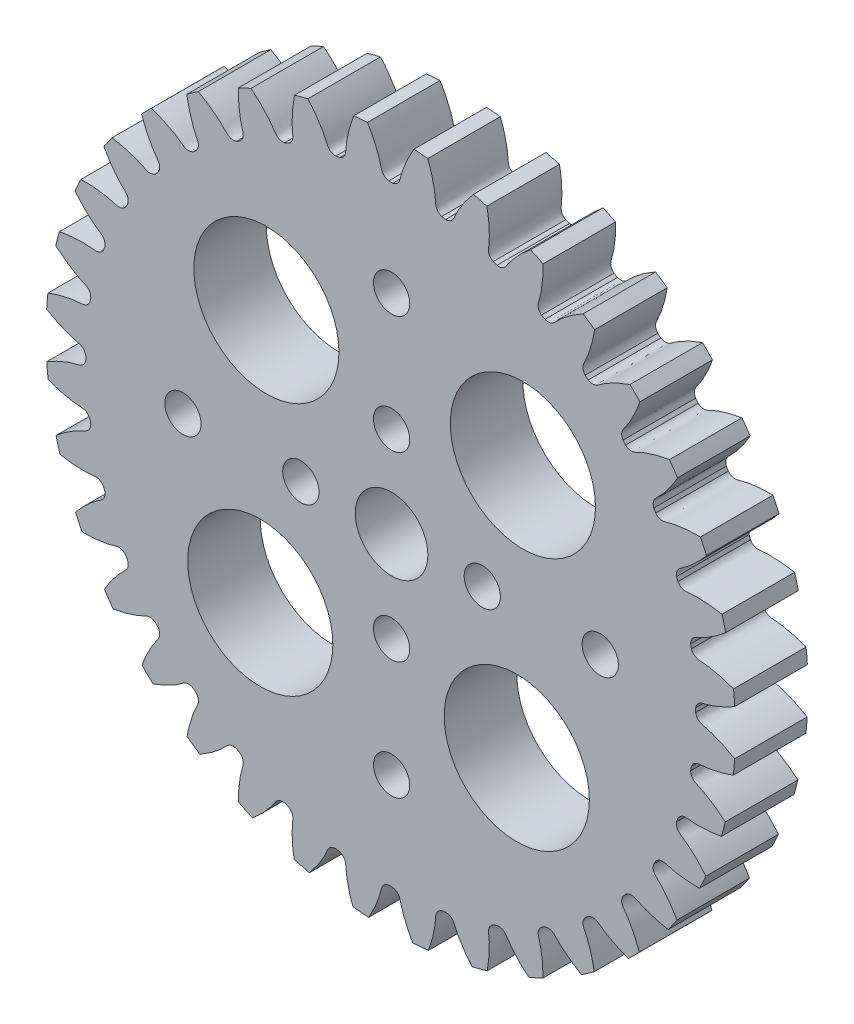
from build123d import *

# Parameters (mm, degrees)
SKETCH_1_R      = 2
SKETCH_1_R_2    = 1
SKETCH_1_R_3    = 4
EXTRUDE_1_DEPTH = 4


with BuildPart() as part:
    # 草图1 → 凸台-拉伸1 (new body)
    with BuildSketch(Plane.XY):
        with BuildLine():
            ThreePointArc((-459.348027108, -100.926579021), (-459.456289472, -100.9453027), (-459.564426692, -100.964736106))
            add(Edge.make_bspline(
                [(-459.564426692, -100.964736106), (-459.933069433, -100.947728892), (-460.010211926, -100.688966681), (-460.133844204, -100.4222656), (-460.170612131, -100.346544695), (-460.227853895, -100.234569806), (-460.311855228, -100.082027758), (-460.430371508, -99.885766039), (-460.571520927, -99.67178836), (-460.736888328, -99.441628893), (-460.914866275, -99.213695983), (-461.040142881, -99.064645204), (-461.099923334, -98.995759227)],
                knots=[0, 0, 0, 0, 0.120371484, 0.133302531, 0.147363917, 0.16255564, 0.196330101, 0.234625915, 0.277443082, 0.324781601, 0.376641473, 0.422355164, 0.422355164, 0.422355164, 0.422355164], degree=3))
            ThreePointArc((-461.099923334, -98.995759227), (-461.469592827, -99.091140869), (-461.83727124, -99.193930832))
            add(Edge.make_bspline(
                [(-462.182439522, -101.666230616), (-461.87168915, -101.467180565), (-461.934262897, -101.204514671), (-461.960544744, -100.911728621), (-461.966563238, -100.827768429), (-461.97297786, -100.702174449), (-461.976501596, -100.528068494), (-461.971994346, -100.298842719), (-461.956744203, -100.042957903), (-461.928611566, -99.760950258), (-461.888474433, -99.47477831), (-461.854552188, -99.283268508), (-461.83727124, -99.193930832)],
                knots=[0, 0, 0, 0, 0.120371484, 0.133302531, 0.147363917, 0.16255564, 0.196330101, 0.234625915, 0.277443082, 0.324781601, 0.376641473, 0.422247529, 0.422247529, 0.422247529, 0.422247529], degree=3))
            ThreePointArc((-462.182439522, -101.666230616), (-462.285805805, -101.703469402), (-462.388925602, -101.741385402))
            add(Edge.make_bspline(
                [(-462.388925602, -101.741385402), (-462.754921104, -101.788650706), (-462.875825215, -101.547215328), (-463.043891397, -101.306034556), (-463.093249534, -101.237848704), (-463.169065903, -101.137514894), (-463.278279715, -101.00187698), (-463.429075957, -100.829177054), (-463.605237833, -100.642960516), (-463.808059704, -100.445013437), (-464.022047788, -100.252229175), (-464.170382718, -100.127913898), (-464.240288777, -100.071161198)],
                knots=[0, 0, 0, 0, 0.120371484, 0.133302531, 0.147363917, 0.16255564, 0.196330101, 0.234625915, 0.277443082, 0.324781601, 0.376641473, 0.421771001, 0.421771001, 0.421771001, 0.421771001], degree=3))
            ThreePointArc((-464.240288777, -100.071161198), (-464.589184221, -100.230109869), (-464.934801412, -100.396066095))
            add(Edge.make_bspline(
                [(-464.845351691, -102.886835791), (-464.573886994, -102.636848522), (-464.681121559, -102.38903893), (-464.75784589, -102.105264753), (-464.778352484, -102.023625206), (-464.80647882, -101.901053168), (-464.840182204, -101.730204164), (-464.875548067, -101.503678168), (-464.90496354, -101.249032658), (-464.926228415, -100.966424161), (-464.936348448, -100.678932408), (-464.9362444, -100.485745285), (-464.934801412, -100.396066095)],
                knots=[0, 0, 0, 0, 0.120371484, 0.133302531, 0.147363917, 0.16255564, 0.196330101, 0.234625915, 0.277443082, 0.324781601, 0.376641473, 0.421594522, 0.421594522, 0.421594522, 0.421594522], degree=3))
            ThreePointArc((-464.845351691, -102.886835791), (-464.94068116, -102.941458203), (-465.035650292, -102.996704739))
            add(Edge.make_bspline(
                [(-465.035650292, -102.996704739), (-465.387877966, -103.106806429), (-465.548870085, -102.890033775), (-465.756263566, -102.681701467), (-465.816712191, -102.623122462), (-465.908799522, -102.537478322), (-466.039907407, -102.422865833), (-466.218401743, -102.278975099), (-466.424223487, -102.126177798), (-466.658337187, -101.966457627), (-466.90107597, -101.814683076), (-467.067205944, -101.718830417), (-467.144358934, -101.675877448)],
                knots=[0, 0, 0, 0, 0.120371484, 0.133302531, 0.147363917, 0.16255564, 0.196330101, 0.234625915, 0.277443082, 0.324781601, 0.376641473, 0.420899304, 0.420899304, 0.420899304, 0.420899304], degree=3))
            ThreePointArc((-467.144358934, -101.675877448), (-467.462218462, -101.894456412), (-467.775574852, -102.11944356))
            add(Edge.make_bspline(
                [(-467.255852377, -104.551307077), (-467.031921672, -104.257978326), (-467.180558787, -104.032554605), (-467.305394372, -103.766414636), (-467.339765983, -103.68957631), (-467.388749427, -103.573750503), (-467.4516084, -103.411349611), (-467.525772802, -103.194406271), (-467.598960117, -102.948737342), (-467.668976381, -102.67411491), (-467.728476154, -102.394575396), (-467.761661729, -102.206157446), (-467.775574852, -102.11944356)],
                knots=[0, 0, 0, 0, 0.120371484, 0.133302531, 0.147363917, 0.16255564, 0.196330101, 0.234625915, 0.277443082, 0.324781601, 0.376641473, 0.420658365, 0.420658365, 0.420658365, 0.420658365], degree=3))
            ThreePointArc((-467.255852377, -104.551307077), (-467.340248495, -104.62165344), (-467.424181371, -104.692551874))
            add(Edge.make_bspline(
                [(-467.424181371, -104.692551874), (-467.751938958, -104.862144565), (-467.948127421, -104.676621163), (-468.188546655, -104.507467391), (-468.258249067, -104.460275127), (-468.363809333, -104.39192291), (-468.512827645, -104.301818288), (-468.713596615, -104.191108794), (-468.942824437, -104.076373397), (-469.20111654, -103.959733153), (-469.464428245, -103.853262543), (-469.642527543, -103.788412462), (-469.723810371, -103.760185061)],
                knots=[0, 0, 0, 0, 0.120371484, 0.133302531, 0.147363917, 0.16255564, 0.196330101, 0.234625915, 0.277443082, 0.324781601, 0.376641473, 0.419767084, 0.419767084, 0.419767084, 0.419767084], degree=3))
            ThreePointArc((-469.723810371, -103.760185061), (-470.000963189, -104.032852292), (-470.27247872, -104.31113348))
            add(Edge.make_bspline(
                [(-469.340699735, -106.609070355), (-469.171107044, -106.281312768), (-469.356630446, -106.085124304), (-469.525784218, -105.844705071), (-469.572976482, -105.775002659), (-469.641328698, -105.669442393), (-469.731433321, -105.520424081), (-469.842142815, -105.319655111), (-469.956878212, -105.090427289), (-470.073518456, -104.832135186), (-470.179765186, -104.569377156), (-470.244430425, -104.391846416), (-470.27247872, -104.31113348)],
                knots=[0, 0, 0, 0, 0.120371484, 0.133302531, 0.147363917, 0.16255564, 0.196330101, 0.234625915, 0.277443082, 0.324781601, 0.376641473, 0.419467813, 0.419467813, 0.419467813, 0.419467813], degree=3))
            ThreePointArc((-469.340699735, -106.609070355), (-469.411598169, -106.693003231), (-469.481944532, -106.777399349))
            add(Edge.make_bspline(
                [(-469.481944532, -106.777399349), (-469.775273283, -107.001330054), (-470.000697004, -106.852692939), (-470.266836973, -106.727857354), (-470.343675299, -106.693485743), (-470.459501106, -106.644502298), (-470.621901998, -106.581643326), (-470.838845338, -106.507478923), (-471.084514267, -106.434291609), (-471.359136699, -106.364275345), (-471.634286203, -106.305709982), (-471.818254999, -106.273150739), (-471.900517359, -106.259819993)],
                knots=[0, 0, 0, 0, 0.120371484, 0.133302531, 0.147363917, 0.16255564, 0.196330101, 0.234625915, 0.277443082, 0.324781601, 0.376641473, 0.418409251, 0.418409251, 0.418409251, 0.418409251], degree=3))
            ThreePointArc((-471.900517359, -106.259819993), (-472.128129052, -106.579462013), (-472.349091098, -106.903736399))
            add(Edge.make_bspline(
                [(-471.036546734, -108.997601529), (-470.926445044, -108.645373855), (-471.143217698, -108.484381736), (-471.351550007, -108.276988255), (-471.410129011, -108.21653963), (-471.495773151, -108.124452299), (-471.61038564, -107.993344413), (-471.754276374, -107.814850078), (-471.907073676, -107.609028334), (-472.066793846, -107.374914634), (-472.215563905, -107.136981049), (-472.308751868, -106.975859374), (-472.349091098, -106.903736399)],
                knots=[0, 0, 0, 0, 0.120371484, 0.133302531, 0.147363917, 0.16255564, 0.196330101, 0.234625915, 0.277443082, 0.324781601, 0.376641473, 0.418059479, 0.418059479, 0.418059479, 0.418059479], degree=3))
            ThreePointArc((-471.036546734, -108.997601529), (-471.09179327, -109.09257066), (-471.146415682, -109.187900129))
            add(Edge.make_bspline(
                [(-471.146415682, -109.187900129), (-471.396402951, -109.459364827), (-471.644212543, -109.352130262), (-471.92798672, -109.27540593), (-472.009626267, -109.254899337), (-472.132198305, -109.226773001), (-472.30304731, -109.193069617), (-472.529573306, -109.157703754), (-472.784218815, -109.128288281), (-473.066827312, -109.107023406), (-473.344891605, -109.09723523), (-473.528641316, -109.097013991), (-473.608894091, -109.098041616)],
                knots=[0, 0, 0, 0, 0.120371484, 0.133302531, 0.147363917, 0.16255564, 0.196330101, 0.234625915, 0.277443082, 0.324781601, 0.376641473, 0.416867492, 0.416867492, 0.416867492, 0.416867492], degree=3))
            ThreePointArc((-473.608894091, -109.098041616), (-473.779236201, -109.456047275), (-473.94207128, -109.817529256))
            add(Edge.make_bspline(
                [(-472.291865921, -111.644326289), (-472.244600617, -111.278330787), (-472.486035995, -111.157426676), (-472.727216768, -110.989360494), (-472.795402619, -110.940002356), (-472.895736429, -110.864185988), (-473.031374343, -110.754972176), (-473.204074269, -110.604175934), (-473.390290807, -110.428014058), (-473.588237887, -110.225192187), (-473.773950309, -110.019053754), (-473.891749768, -109.879049569), (-473.94207128, -109.817529256)],
                knots=[0, 0, 0, 0, 0.120371484, 0.133302531, 0.147363917, 0.16255564, 0.196330101, 0.234625915, 0.277443082, 0.324781601, 0.376641473, 0.416476669, 0.416476669, 0.416476669, 0.416476669], degree=3))
            ThreePointArc((-472.291865921, -111.644326289), (-472.329781921, -111.747446086), (-472.367020708, -111.850812369))
            add(Edge.make_bspline(
                [(-472.367020708, -111.850812369), (-472.566070758, -112.161562741), (-472.828736653, -112.098988994), (-473.121522703, -112.072707146), (-473.205482894, -112.066688653), (-473.331076874, -112.06027403), (-473.50518283, -112.056750294), (-473.734408604, -112.061257545), (-473.99029342, -112.076507688), (-474.272301065, -112.104640324), (-474.544523402, -112.142820951), (-474.722238503, -112.173822989), (-474.797819897, -112.188058473)],
                knots=[0, 0, 0, 0, 0.120371484, 0.133302531, 0.147363917, 0.16255564, 0.196330101, 0.234625915, 0.277443082, 0.324781601, 0.376641473, 0.415188955, 0.415188955, 0.415188955, 0.415188955], degree=3))
            ThreePointArc((-474.797819897, -112.188058473), (-474.904554825, -112.574448158), (-475.003114427, -112.963003609))
            add(Edge.make_bspline(
                [(-473.068515057, -114.468825242), (-473.085522271, -114.1001825), (-473.344284482, -114.023040008), (-473.610985563, -113.89940773), (-473.686706469, -113.862639802), (-473.798681357, -113.805398038), (-473.951223406, -113.721396706), (-474.147485125, -113.602880425), (-474.361462804, -113.461731006), (-474.59162227, -113.296363605), (-474.807621304, -113.127704044), (-474.945399241, -113.012558304), (-475.003114427, -112.963003609)],
                knots=[0, 0, 0, 0, 0.120371484, 0.133302531, 0.147363917, 0.16255564, 0.196330101, 0.234625915, 0.277443082, 0.324781601, 0.376641473, 0.414768007, 0.414768007, 0.414768007, 0.414768007], degree=3))
            ThreePointArc((-473.068515057, -114.468825242), (-473.087948463, -114.576962462), (-473.106672143, -114.685224826))
            add(Edge.make_bspline(
                [(-473.106672143, -114.685224826), (-473.248736939, -115.02581888), (-473.518278166, -115.009807223), (-473.811179933, -115.03476642), (-473.894909681, -115.043418895), (-474.019709494, -115.058910891), (-474.191782279, -115.08567387), (-474.416742923, -115.129917283), (-474.666092114, -115.189369674), (-474.938930248, -115.266045027), (-475.19703832, -115.349829527), (-475.363397677, -115.409913796), (-475.432097367, -115.435730535)],
                knots=[0, 0, 0, 0, 0.120371484, 0.133302531, 0.147363917, 0.16255564, 0.196330101, 0.234625915, 0.277443082, 0.324781601, 0.376641473, 0.413424779, 0.413424779, 0.413424779, 0.413424779], degree=3))
            ThreePointArc((-475.432097367, -115.435730535), (-475.470563074, -115.839353059), (-475.500407393, -116.243704476))
            add(Edge.make_bspline(
                [(-473.342896052, -117.385277416), (-473.423659029, -117.025188458), (-473.691885713, -116.994151519), (-473.976003525, -116.918709651), (-474.056958744, -116.895649108), (-474.17717241, -116.85872121), (-474.34198368, -116.802484695), (-474.555843879, -116.719849433), (-474.791081096, -116.618001225), (-475.046459671, -116.495112898), (-475.285324029, -116.368192248), (-475.437976854, -116.280593679), (-475.500407393, -116.243704476)],
                knots=[0, 0, 0, 0, 0.120371484, 0.133302531, 0.147363917, 0.16255564, 0.196330101, 0.234625915, 0.277443082, 0.324781601, 0.376641473, 0.412985889, 0.412985889, 0.412985889, 0.412985889], degree=3))
            ThreePointArc((-473.342896052, -117.385277416), (-473.34325639, -117.495146364), (-473.342896052, -117.605015313))
            add(Edge.make_bspline(
                [(-473.342896052, -117.605015313), (-473.423659029, -117.965104271), (-473.691885713, -117.996141209), (-473.976003525, -118.071583078), (-474.056958744, -118.094643621), (-474.17717241, -118.131571519), (-474.34198368, -118.187808034), (-474.555843879, -118.270443296), (-474.791081096, -118.372291504), (-475.046459671, -118.495179831), (-475.282931971, -118.62082946), (-475.433277879, -118.707004202), (-475.493410592, -118.742458447)],
                knots=[0, 0, 0, 0, 0.120371484, 0.133302531, 0.147363917, 0.16255564, 0.196330101, 0.234625915, 0.277443082, 0.324781601, 0.376641473, 0.411628523, 0.411628523, 0.411628523, 0.411628523], degree=3))
            ThreePointArc((-475.493410592, -118.742458447), (-475.460884536, -119.151262189), (-475.419542957, -119.559268706))
            add(Edge.make_bspline(
                [(-473.106671978, -120.305067889), (-473.248736775, -119.964473834), (-473.518278001, -119.980485492), (-473.811179768, -119.955526295), (-473.894909516, -119.946873819), (-474.019709329, -119.931381824), (-474.191782114, -119.904618845), (-474.416742758, -119.860375431), (-474.666091949, -119.80092304), (-474.938930084, -119.724247688), (-475.192786496, -119.641843319), (-475.354988768, -119.583411905), (-475.419542957, -119.559268706)],
                knots=[0, 0, 0, 0, 0.120371484, 0.133302531, 0.147363917, 0.16255564, 0.196330101, 0.234625915, 0.277443082, 0.324781601, 0.376641473, 0.411184834, 0.411184834, 0.411184834, 0.411184834], degree=3))
            ThreePointArc((-473.106671978, -120.305067889), (-473.087948298, -120.413330253), (-473.068514892, -120.521467472))
            add(Edge.make_bspline(
                [(-473.068514892, -120.521467472), (-473.085522106, -120.890110214), (-473.344284317, -120.967252707), (-473.610985398, -121.090884984), (-473.686706304, -121.127652912), (-473.798681193, -121.184894676), (-473.951223241, -121.268896009), (-474.14748496, -121.387412289), (-474.361462639, -121.528561708), (-474.591622106, -121.693929109), (-474.799892739, -121.856554067), (-474.930341861, -121.965173964), (-474.980767646, -122.008168865)],
                knots=[0, 0, 0, 0, 0.120371484, 0.133302531, 0.147363917, 0.16255564, 0.196330101, 0.234625915, 0.277443082, 0.324781601, 0.376641473, 0.40985455, 0.40985455, 0.40985455, 0.40985455], degree=3))
            ThreePointArc((-474.980767646, -122.008168865), (-474.876686611, -122.40954649), (-474.763871287, -122.80855722))
            add(Edge.make_bspline(
                [(-472.367020383, -123.139480303), (-472.566070433, -122.828729931), (-472.828736328, -122.891303678), (-473.121522378, -122.917585525), (-473.205482569, -122.923604019), (-473.33107655, -122.930018641), (-473.505182505, -122.933542377), (-473.73440828, -122.929035127), (-473.990293095, -122.913784984), (-474.272300741, -122.885652347), (-474.533121661, -122.84907083), (-474.699553257, -122.820401947), (-474.763871287, -122.80855722)],
                knots=[0, 0, 0, 0, 0.120371484, 0.133302531, 0.147363917, 0.16255564, 0.196330101, 0.234625915, 0.277443082, 0.324781601, 0.376641473, 0.409419781, 0.409419781, 0.409419781, 0.409419781], degree=3))
            ThreePointArc((-472.367020383, -123.139480303), (-472.329781596, -123.242846586), (-472.291865596, -123.345966383))
            add(Edge.make_bspline(
                [(-472.291865596, -123.345966383), (-472.244600292, -123.711961884), (-472.48603567, -123.832865996), (-472.727216443, -124.000932178), (-472.795402294, -124.050290315), (-472.895736105, -124.126106683), (-473.031374018, -124.235320496), (-473.204073944, -124.386116738), (-473.390290482, -124.562278614), (-473.588237562, -124.765100484), (-473.762836279, -124.958902846), (-473.870332894, -125.085869207), (-473.910427278, -125.134306724)],
                knots=[0, 0, 0, 0, 0.120371484, 0.133302531, 0.147363917, 0.16255564, 0.196330101, 0.234625915, 0.277443082, 0.324781601, 0.376641473, 0.408156395, 0.408156395, 0.408156395, 0.408156395], degree=3))
            ThreePointArc((-473.910427278, -125.134306724), (-473.736539694, -125.515504757), (-473.554288771, -125.892775792))
            add(Edge.make_bspline(
                [(-471.146415208, -125.802392472), (-471.396402476, -125.530927775), (-471.644212069, -125.63816234), (-471.927986246, -125.714886671), (-472.009625793, -125.735393264), (-472.132197831, -125.7635196), (-472.303046835, -125.797222985), (-472.529572831, -125.832588848), (-472.784218341, -125.862004321), (-473.066826837, -125.883269196), (-473.326696275, -125.892416892), (-473.492233191, -125.893173203), (-473.554288771, -125.892775792)],
                knots=[0, 0, 0, 0, 0.120371484, 0.133302531, 0.147363917, 0.16255564, 0.196330101, 0.234625915, 0.277443082, 0.324781601, 0.376641473, 0.407744397, 0.407744397, 0.407744397, 0.407744397], degree=3))
            ThreePointArc((-471.146415208, -125.802392472), (-471.091792795, -125.897721941), (-471.03654626, -125.992691073))
            add(Edge.make_bspline(
                [(-471.03654626, -125.992691073), (-470.92644457, -126.344918747), (-471.143217223, -126.505910866), (-471.351549532, -126.713304347), (-471.410128536, -126.773752972), (-471.495772676, -126.865840303), (-471.610385166, -126.996948188), (-471.754275899, -127.175442524), (-471.907073201, -127.381264268), (-472.066793371, -127.615377968), (-472.203423799, -127.833896181), (-472.285741516, -127.974843545), (-472.315324073, -128.026749388)],
                knots=[0, 0, 0, 0, 0.120371484, 0.133302531, 0.147363917, 0.16255564, 0.196330101, 0.234625915, 0.277443082, 0.324781601, 0.376641473, 0.406585186, 0.406585186, 0.406585186, 0.406585186], degree=3))
            ThreePointArc((-472.315324073, -128.026749388), (-472.075754143, -128.375326211), (-471.828484273, -128.718483849))
            add(Edge.make_bspline(
                [(-469.481943922, -128.212893158), (-469.775272672, -127.988962453), (-470.000696393, -128.137599568), (-470.266836363, -128.262435153), (-470.343674689, -128.296806764), (-470.459500495, -128.345790208), (-470.621901388, -128.408649181), (-470.838844727, -128.482813583), (-471.084513656, -128.556000898), (-471.359136088, -128.626017162), (-471.610472985, -128.67951403), (-471.770332561, -128.708548787), (-471.828484273, -128.718483849)],
                knots=[0, 0, 0, 0, 0.120371484, 0.133302531, 0.147363917, 0.16255564, 0.196330101, 0.234625915, 0.277443082, 0.324781601, 0.376641473, 0.406209439, 0.406209439, 0.406209439, 0.406209439], degree=3))
            ThreePointArc((-469.481943922, -128.212893158), (-469.411597558, -128.297289276), (-469.340699125, -128.381222152))
            add(Edge.make_bspline(
                [(-469.340699125, -128.381222152), (-469.171106434, -128.708979739), (-469.356629835, -128.905168202), (-469.525783608, -129.145587436), (-469.572975872, -129.215289848), (-469.641328088, -129.320850114), (-469.731432711, -129.469868426), (-469.842142205, -129.670637395), (-469.956877601, -129.899865218), (-470.073517846, -130.158157321), (-470.169082155, -130.394496731), (-470.224784832, -130.544952984), (-470.244018922, -130.598563664)],
                knots=[0, 0, 0, 0, 0.120371484, 0.133302531, 0.147363917, 0.16255564, 0.196330101, 0.234625915, 0.277443082, 0.324781601, 0.376641473, 0.405188146, 0.405188146, 0.405188146, 0.405188146], degree=3))
            ThreePointArc((-470.244018922, -130.598563664), (-469.945227081, -130.902872947), (-469.639680402, -131.2003993))
            add(Edge.make_bspline(
                [(-467.424180644, -130.297740516), (-467.75193823, -130.128147825), (-467.948126694, -130.313671227), (-468.188545928, -130.482824999), (-468.25824834, -130.530017263), (-468.363808606, -130.598369479), (-468.512826918, -130.688474102), (-468.713595887, -130.799183596), (-468.942823709, -130.913918992), (-469.201115813, -131.030559237), (-469.436850405, -131.125878987), (-469.586688069, -131.181373202), (-469.639680402, -131.2003993)],
                knots=[0, 0, 0, 0, 0.120371484, 0.133302531, 0.147363917, 0.16255564, 0.196330101, 0.234625915, 0.277443082, 0.324781601, 0.376641473, 0.404861233, 0.404861233, 0.404861233, 0.404861233], degree=3))
            ThreePointArc((-467.424180644, -130.297740516), (-467.340247768, -130.368638949), (-467.25585165, -130.438985313))
            add(Edge.make_bspline(
                [(-467.25585165, -130.438985313), (-467.031920945, -130.732314064), (-467.18055806, -130.957737784), (-467.305393645, -131.223877754), (-467.339765255, -131.30071608), (-467.3887487, -131.416541887), (-467.451607673, -131.578942779), (-467.525772075, -131.795886119), (-467.59895939, -132.041555048), (-467.668975654, -132.31617748), (-467.721557582, -132.563215905), (-467.74993327, -132.718727804), (-467.759212321, -132.77253398)],
                knots=[0, 0, 0, 0, 0.120371484, 0.133302531, 0.147363917, 0.16255564, 0.196330101, 0.234625915, 0.277443082, 0.324781601, 0.376641473, 0.404007217, 0.404007217, 0.404007217, 0.404007217], degree=3))
            ThreePointArc((-467.759212321, -132.77253398), (-467.409843695, -133.022205955), (-467.054921913, -133.26391872))
            add(Edge.make_bspline(
                [(-465.035649469, -131.993587515), (-465.387877143, -131.883485825), (-465.548869263, -132.100258479), (-465.756262744, -132.308590787), (-465.816711369, -132.367169792), (-465.9087987, -132.452813932), (-466.039906585, -132.567426421), (-466.218400921, -132.711317155), (-466.424222665, -132.864114457), (-466.658336365, -133.023834627), (-466.872040843, -133.157455195), (-467.008001557, -133.23705212), (-467.054921913, -133.26391872)],
                knots=[0, 0, 0, 0, 0.120371484, 0.133302531, 0.147363917, 0.16255564, 0.196330101, 0.234625915, 0.277443082, 0.324781601, 0.376641473, 0.403740302, 0.403740302, 0.403740302, 0.403740302], degree=3))
            ThreePointArc((-465.035649469, -131.993587515), (-464.940680338, -132.048834051), (-464.845350869, -132.103456463))
            add(Edge.make_bspline(
                [(-464.845350869, -132.103456463), (-464.573886172, -132.353443732), (-464.681120737, -132.601253324), (-464.757845068, -132.885027501), (-464.778351661, -132.966667048), (-464.806477997, -133.089239086), (-464.840181382, -133.26008809), (-464.875547245, -133.486614086), (-464.904962718, -133.741259596), (-464.926227592, -134.023868093), (-464.935047621, -134.274430727), (-464.936030454, -134.430652248), (-464.935866966, -134.483398135)],
                knots=[0, 0, 0, 0, 0.120371484, 0.133302531, 0.147363917, 0.16255564, 0.196330101, 0.234625915, 0.277443082, 0.324781601, 0.376641473, 0.403077851, 0.403077851, 0.403077851, 0.403077851], degree=3))
            ThreePointArc((-464.935866966, -134.483398135), (-464.546487833, -134.66978897), (-464.152974564, -134.847285335))
            add(Edge.make_bspline(
                [(-462.38892471, -133.248906702), (-462.754920211, -133.201641398), (-462.875824323, -133.443076776), (-463.043890505, -133.684257549), (-463.093248642, -133.7524434), (-463.16906501, -133.85277721), (-463.278278823, -133.988415124), (-463.429075065, -134.16111505), (-463.605236941, -134.347331588), (-463.808058811, -134.545278667), (-463.994038471, -134.712829735), (-464.112771379, -134.813753082), (-464.152974564, -134.847285335)],
                knots=[0, 0, 0, 0, 0.120371484, 0.133302531, 0.147363917, 0.16255564, 0.196330101, 0.234625915, 0.277443082, 0.324781601, 0.376641473, 0.402880193, 0.402880193, 0.402880193, 0.402880193], degree=3))
            ThreePointArc((-462.38892471, -133.248906702), (-462.285804913, -133.286822702), (-462.18243863, -133.324061489))
            add(Edge.make_bspline(
                [(-462.18243863, -133.324061489), (-461.871688258, -133.523111539), (-461.934262005, -133.785777433), (-461.960543852, -134.078563483), (-461.966562346, -134.162523675), (-461.972976968, -134.288117655), (-461.976500704, -134.46222361), (-461.971993454, -134.691449385), (-461.956743311, -134.947334201), (-461.928610674, -135.229341846), (-461.893967062, -135.476345144), (-461.868061234, -135.62909147), (-461.858993509, -135.679735607)],
                knots=[0, 0, 0, 0, 0.120371484, 0.133302531, 0.147363917, 0.16255564, 0.196330101, 0.234625915, 0.277443082, 0.324781601, 0.376641473, 0.402427979, 0.402427979, 0.402427979, 0.402427979], degree=3))
            ThreePointArc((-461.858993509, -135.679735607), (-461.44172446, -135.796315643), (-461.021905741, -135.903351187))
            add(Edge.make_bspline(
                [(-459.564425757, -134.025555838), (-459.933068498, -134.042563052), (-460.010210991, -134.301325263), (-460.133843269, -134.568026344), (-460.170611196, -134.643747249), (-460.22785296, -134.755722138), (-460.311854293, -134.908264186), (-460.430370573, -135.104525905), (-460.571519992, -135.318503585), (-460.736887393, -135.548663051), (-460.89024212, -135.745061326), (-460.988890437, -135.864208321), (-461.021905741, -135.903351187)],
                knots=[0, 0, 0, 0, 0.120371484, 0.133302531, 0.147363917, 0.16255564, 0.196330101, 0.234625915, 0.277443082, 0.324781601, 0.376641473, 0.402306517, 0.402306517, 0.402306517, 0.402306517], degree=3))
            ThreePointArc((-459.564425757, -134.025555838), (-459.456288537, -134.044989244), (-459.348026173, -134.063712923))
            add(Edge.make_bspline(
                [(-459.348026173, -134.063712923), (-459.007432118, -134.20577772), (-459.023443776, -134.475318947), (-458.998484579, -134.768220714), (-458.989832104, -134.851950462), (-458.974340108, -134.976750275), (-458.947577129, -135.14882306), (-458.903333715, -135.373783704), (-458.843881325, -135.623132895), (-458.767205972, -135.895971029), (-458.690413113, -136.13254018), (-458.638630696, -136.277814738), (-458.621159462, -136.325462211)],
                knots=[0, 0, 0, 0, 0.120371484, 0.133302531, 0.147363917, 0.16255564, 0.196330101, 0.234625915, 0.277443082, 0.324781601, 0.376641473, 0.402077201, 0.402077201, 0.402077201, 0.402077201], degree=3))
            ThreePointArc((-458.621159462, -136.325462211), (-458.189222094, -136.368116921), (-457.756423084, -136.400893914))
            add(Edge.make_bspline(
                [(-456.647973582, -134.299936833), (-457.008062541, -134.38069981), (-457.039099479, -134.648926494), (-457.114541348, -134.933044306), (-457.137601891, -135.013999525), (-457.174529788, -135.134213191), (-457.230766303, -135.299024461), (-457.313401566, -135.51288466), (-457.415249774, -135.748121877), (-457.5381381, -136.003500452), (-457.654805746, -136.223068449), (-457.730985696, -136.35707411), (-457.756423084, -136.400893914)],
                knots=[0, 0, 0, 0, 0.120371484, 0.133302531, 0.147363917, 0.16255564, 0.196330101, 0.234625915, 0.277443082, 0.324781601, 0.376641473, 0.402036233, 0.402036233, 0.402036233, 0.402036233], degree=3))
            ThreePointArc((-456.647973582, -134.299936833), (-456.538104634, -134.300297171), (-456.428235686, -134.299936833))
            add(Edge.make_bspline(
                [(-456.428235686, -134.299936833), (-456.068146728, -134.38069981), (-456.037109789, -134.648926494), (-455.96166792, -134.933044306), (-455.938607378, -135.013999525), (-455.90167948, -135.134213191), (-455.845442965, -135.299024461), (-455.762807703, -135.51288466), (-455.660959495, -135.748121877), (-455.538071168, -136.003500452), (-455.421403544, -136.223068409), (-455.345223617, -136.357074031), (-455.319786252, -136.400893796)],
                knots=[0, 0, 0, 0, 0.120371484, 0.133302531, 0.147363917, 0.16255564, 0.196330101, 0.234625915, 0.277443082, 0.324781601, 0.376641473, 0.402036211, 0.402036211, 0.402036211, 0.402036211], degree=3))
            ThreePointArc((-455.319786252, -136.400893796), (-454.886987207, -136.368116758), (-454.455049804, -136.325462001))
            add(Edge.make_bspline(
                [(-453.72818311, -134.063712759), (-454.068777164, -134.205777555), (-454.052765507, -134.475318782), (-454.077724704, -134.768220549), (-454.086377179, -134.851950297), (-454.101869175, -134.97675011), (-454.128632154, -135.148822895), (-454.172875567, -135.373783539), (-454.232327958, -135.62313273), (-454.309003311, -135.895970864), (-454.385796165, -136.13254), (-454.437578576, -136.277814543), (-454.455049804, -136.325462001)],
                knots=[0, 0, 0, 0, 0.120371484, 0.133302531, 0.147363917, 0.16255564, 0.196330101, 0.234625915, 0.277443082, 0.324781601, 0.376641473, 0.402077193, 0.402077193, 0.402077193, 0.402077193], degree=3))
            ThreePointArc((-453.72818311, -134.063712759), (-453.619920746, -134.044989079), (-453.511783526, -134.025555673))
            add(Edge.make_bspline(
                [(-453.511783526, -134.025555673), (-453.143140784, -134.042562887), (-453.065998292, -134.301325098), (-452.942366014, -134.568026179), (-452.905598087, -134.643747085), (-452.848356323, -134.755721973), (-452.76435499, -134.908264022), (-452.645838709, -135.104525741), (-452.50468929, -135.31850342), (-452.339321889, -135.548662886), (-452.185967228, -135.745061078), (-452.087318981, -135.864207993), (-452.054303747, -135.90335078)],
                knots=[0, 0, 0, 0, 0.120371484, 0.133302531, 0.147363917, 0.16255564, 0.196330101, 0.234625915, 0.277443082, 0.324781601, 0.376641473, 0.402306464, 0.402306464, 0.402306464, 0.402306464], degree=3))
            ThreePointArc((-452.054303747, -135.90335078), (-451.634484926, -135.796315167), (-451.217215777, -135.679735058))
            add(Edge.make_bspline(
                [(-450.893770696, -133.324061164), (-451.204521068, -133.523111214), (-451.141947321, -133.785777109), (-451.115665473, -134.078563159), (-451.10964698, -134.16252335), (-451.103232357, -134.288117331), (-451.099708621, -134.462223286), (-451.104215872, -134.69144906), (-451.119466015, -134.947333876), (-451.147598651, -135.229341522), (-451.182242253, -135.476344744), (-451.208148066, -135.629090996), (-451.217215777, -135.679735058)],
                knots=[0, 0, 0, 0, 0.120371484, 0.133302531, 0.147363917, 0.16255564, 0.196330101, 0.234625915, 0.277443082, 0.324781601, 0.376641473, 0.402427941, 0.402427941, 0.402427941, 0.402427941], degree=3))
            ThreePointArc((-450.893770696, -133.324061164), (-450.790404413, -133.286822377), (-450.687284616, -133.248906377))
            add(Edge.make_bspline(
                [(-450.687284616, -133.248906377), (-450.321289114, -133.201641073), (-450.200385003, -133.443076451), (-450.032318821, -133.684257224), (-449.982960683, -133.752443075), (-449.907144315, -133.852776886), (-449.797930503, -133.988414799), (-449.647134261, -134.161114725), (-449.470972385, -134.347331263), (-449.268150514, -134.545278343), (-449.082170977, -134.7128293), (-448.963438197, -134.813752545), (-448.92323514, -134.847284694)],
                knots=[0, 0, 0, 0, 0.120371484, 0.133302531, 0.147363917, 0.16255564, 0.196330101, 0.234625915, 0.277443082, 0.324781601, 0.376641473, 0.402880111, 0.402880111, 0.402880111, 0.402880111], degree=3))
            ThreePointArc((-448.92323514, -134.847284694), (-448.529721714, -134.669788217), (-448.140342429, -134.483397262))
            add(Edge.make_bspline(
                [(-448.230858526, -132.103455989), (-448.502323224, -132.353443257), (-448.395088658, -132.601252849), (-448.318364327, -132.885027026), (-448.297857734, -132.966666574), (-448.269731398, -133.089238612), (-448.236028014, -133.260087616), (-448.200662151, -133.486613612), (-448.171246678, -133.741259121), (-448.149981803, -134.023867618), (-448.141161779, -134.274430119), (-448.140178943, -134.430651508), (-448.140342429, -134.483397262)],
                knots=[0, 0, 0, 0, 0.120371484, 0.133302531, 0.147363917, 0.16255564, 0.196330101, 0.234625915, 0.277443082, 0.324781601, 0.376641473, 0.403077784, 0.403077784, 0.403077784, 0.403077784], degree=3))
            ThreePointArc((-448.230858526, -132.103455989), (-448.135529057, -132.048833576), (-448.040559926, -131.99358704))
            add(Edge.make_bspline(
                [(-448.040559926, -131.99358704), (-447.688332252, -131.883485351), (-447.527340132, -132.100258004), (-447.319946652, -132.308590313), (-447.259498027, -132.367169317), (-447.167410696, -132.452813457), (-447.03630281, -132.567425947), (-446.857808475, -132.71131668), (-446.651986731, -132.864113982), (-446.41787303, -133.023834152), (-446.204168738, -133.157454604), (-446.068208215, -133.237051425), (-446.021288051, -133.263917921)],
                knots=[0, 0, 0, 0, 0.120371484, 0.133302531, 0.147363917, 0.16255564, 0.196330101, 0.234625915, 0.277443082, 0.324781601, 0.376641473, 0.403740192, 0.403740192, 0.403740192, 0.403740192], degree=3))
            ThreePointArc((-446.021288051, -133.263917921), (-445.666366076, -133.022204981), (-445.316997264, -132.772532822))
            add(Edge.make_bspline(
                [(-445.820357841, -130.438984703), (-446.044288546, -130.732313453), (-445.89565143, -130.957737174), (-445.770815846, -131.223877144), (-445.736444235, -131.30071547), (-445.68746079, -131.416541276), (-445.624601818, -131.578942169), (-445.550437415, -131.795885508), (-445.477250101, -132.041554437), (-445.407233837, -132.316176869), (-445.354651947, -132.563215113), (-445.326276287, -132.718726829), (-445.316997264, -132.772532822)],
                knots=[0, 0, 0, 0, 0.120371484, 0.133302531, 0.147363917, 0.16255564, 0.196330101, 0.234625915, 0.277443082, 0.324781601, 0.376641473, 0.404007124, 0.404007124, 0.404007124, 0.404007124], degree=3))
            ThreePointArc((-445.820357841, -130.438984703), (-445.735961723, -130.368638339), (-445.652028846, -130.297739906))
            add(Edge.make_bspline(
                [(-445.652028846, -130.297739906), (-445.32427126, -130.128147214), (-445.128082796, -130.313670616), (-444.887663563, -130.482824389), (-444.817961151, -130.530016653), (-444.712400885, -130.598368869), (-444.563382572, -130.688473492), (-444.362613603, -130.799182986), (-444.133385781, -130.913918382), (-443.875093677, -131.030558627), (-443.639359332, -131.125878277), (-443.489521921, -131.181372407), (-443.43652984, -131.20039842)],
                knots=[0, 0, 0, 0, 0.120371484, 0.133302531, 0.147363917, 0.16255564, 0.196330101, 0.234625915, 0.277443082, 0.324781601, 0.376641473, 0.404861099, 0.404861099, 0.404861099, 0.404861099], degree=3))
            ThreePointArc((-443.43652984, -131.20039842), (-443.130982956, -130.902871821), (-442.83219092, -130.598562283))
            add(Edge.make_bspline(
                [(-443.735510482, -128.381221425), (-443.905103174, -128.708979011), (-443.719579772, -128.905167475), (-443.550426, -129.145586709), (-443.503233736, -129.215289121), (-443.434881519, -129.320849387), (-443.344776897, -129.469867699), (-443.234067403, -129.670636668), (-443.119332006, -129.89986449), (-443.002691762, -130.158156594), (-442.907127539, -130.394495789), (-442.851424936, -130.544951823), (-442.83219092, -130.598562283)],
                knots=[0, 0, 0, 0, 0.120371484, 0.133302531, 0.147363917, 0.16255564, 0.196330101, 0.234625915, 0.277443082, 0.324781601, 0.376641473, 0.40518803, 0.40518803, 0.40518803, 0.40518803], degree=3))
            ThreePointArc((-443.735510482, -128.381221425), (-443.664612049, -128.297288548), (-443.594265685, -128.212892431))
            add(Edge.make_bspline(
                [(-443.594265685, -128.212892431), (-443.300936935, -127.988961726), (-443.075513214, -128.137598841), (-442.809373245, -128.262434426), (-442.732534918, -128.296806036), (-442.616709112, -128.345789481), (-442.454308219, -128.408648454), (-442.23736488, -128.482812856), (-441.991695951, -128.55600017), (-441.717073519, -128.626016435), (-441.465736923, -128.679513238), (-441.305877651, -128.70854795), (-441.247726243, -128.718482966)],
                knots=[0, 0, 0, 0, 0.120371484, 0.133302531, 0.147363917, 0.16255564, 0.196330101, 0.234625915, 0.277443082, 0.324781601, 0.376641473, 0.406209285, 0.406209285, 0.406209285, 0.406209285], degree=3))
            ThreePointArc((-441.247726243, -128.718482966), (-441.00045618, -128.375325012), (-440.760886071, -128.026747863))
            add(Edge.make_bspline(
                [(-442.039663483, -125.99269025), (-442.149765173, -126.344917924), (-441.93299252, -126.505910044), (-441.724660211, -126.713303525), (-441.666081207, -126.77375215), (-441.580437067, -126.86583948), (-441.465824577, -126.996947366), (-441.321933844, -127.175441702), (-441.169136542, -127.381263446), (-441.009416372, -127.615377146), (-440.872786087, -127.83389513), (-440.790468499, -127.974842257), (-440.760886071, -128.026747863)],
                knots=[0, 0, 0, 0, 0.120371484, 0.133302531, 0.147363917, 0.16255564, 0.196330101, 0.234625915, 0.277443082, 0.324781601, 0.376641473, 0.406585051, 0.406585051, 0.406585051, 0.406585051], degree=3))
            ThreePointArc((-442.039663483, -125.99269025), (-441.984416948, -125.897721119), (-441.929794535, -125.80239165))
            add(Edge.make_bspline(
                [(-441.929794535, -125.80239165), (-441.679807267, -125.530926953), (-441.431997674, -125.638161518), (-441.148223497, -125.714885849), (-441.06658395, -125.735392442), (-440.944011912, -125.763518778), (-440.773162908, -125.797222163), (-440.546636912, -125.832588026), (-440.291991402, -125.862003498), (-440.009382906, -125.883268373), (-439.749513808, -125.892416058), (-439.583977232, -125.893172377), (-439.521921991, -125.892774976)],
                knots=[0, 0, 0, 0, 0.120371484, 0.133302531, 0.147363917, 0.16255564, 0.196330101, 0.234625915, 0.277443082, 0.324781601, 0.376641473, 0.407744227, 0.407744227, 0.407744227, 0.407744227], degree=3))
            ThreePointArc((-439.521921991, -125.892774976), (-439.339670912, -125.515503561), (-439.165783187, -125.134305141))
            add(Edge.make_bspline(
                [(-440.784344297, -123.34596549), (-440.831609601, -123.711960992), (-440.590174223, -123.832865104), (-440.34899345, -124.000931286), (-440.280807599, -124.050289423), (-440.180473788, -124.126105791), (-440.044835875, -124.235319604), (-439.872135949, -124.386115846), (-439.685919411, -124.562277722), (-439.487972331, -124.765099592), (-439.313373814, -124.958901732), (-439.205877386, -125.085867858), (-439.165783187, -125.134305141)],
                knots=[0, 0, 0, 0, 0.120371484, 0.133302531, 0.147363917, 0.16255564, 0.196330101, 0.234625915, 0.277443082, 0.324781601, 0.376641473, 0.408156245, 0.408156245, 0.408156245, 0.408156245], degree=3))
            ThreePointArc((-440.784344297, -123.34596549), (-440.746428297, -123.242845693), (-440.70918951, -123.139479411))
            add(Edge.make_bspline(
                [(-440.70918951, -123.139479411), (-440.51013946, -122.828729039), (-440.247473565, -122.891302786), (-439.954687515, -122.917584633), (-439.870727324, -122.923603126), (-439.745133343, -122.930017749), (-439.571027388, -122.933541485), (-439.341801613, -122.929034235), (-439.085916798, -122.913784092), (-438.803909152, -122.885651455), (-438.543088591, -122.849069988), (-438.37665735, -122.820401178), (-438.312339675, -122.808556525)],
                knots=[0, 0, 0, 0, 0.120371484, 0.133302531, 0.147363917, 0.16255564, 0.196330101, 0.234625915, 0.277443082, 0.324781601, 0.376641473, 0.4094196, 0.4094196, 0.4094196, 0.4094196], degree=3))
            ThreePointArc((-438.312339675, -122.808556525), (-438.199524252, -122.409545367), (-438.095443135, -122.008167309))
            add(Edge.make_bspline(
                [(-440.00769516, -120.521466537), (-439.990687946, -120.890109279), (-439.731925735, -120.967251772), (-439.465224655, -121.090884049), (-439.389503749, -121.127651977), (-439.27752886, -121.184893741), (-439.124986812, -121.268895074), (-438.928725093, -121.387411354), (-438.714747414, -121.528560773), (-438.484587947, -121.693928174), (-438.276317565, -121.856552935), (-438.145868683, -121.965172621), (-438.095443135, -122.008167309)],
                knots=[0, 0, 0, 0, 0.120371484, 0.133302531, 0.147363917, 0.16255564, 0.196330101, 0.234625915, 0.277443082, 0.324781601, 0.376641473, 0.40985439, 0.40985439, 0.40985439, 0.40985439], degree=3))
            ThreePointArc((-440.00769516, -120.521466537), (-439.988261754, -120.413329318), (-439.969538075, -120.305066954))
            add(Edge.make_bspline(
                [(-439.969538075, -120.305066954), (-439.827473278, -119.964472899), (-439.557932052, -119.980484557), (-439.265030285, -119.95552536), (-439.181300537, -119.946872884), (-439.056500724, -119.931380889), (-438.884427939, -119.90461791), (-438.659467295, -119.860374496), (-438.410118104, -119.800922105), (-438.137279969, -119.724246753), (-437.883423914, -119.6418425), (-437.72122199, -119.583411224), (-437.656668149, -119.559268165)],
                knots=[0, 0, 0, 0, 0.120371484, 0.133302531, 0.147363917, 0.16255564, 0.196330101, 0.234625915, 0.277443082, 0.324781601, 0.376641473, 0.411184646, 0.411184646, 0.411184646, 0.411184646], degree=3))
            ThreePointArc((-437.656668149, -119.559268165), (-437.615326542, -119.151261194), (-437.582800476, -118.742456997))
            add(Edge.make_bspline(
                [(-439.733314166, -117.605014363), (-439.652551189, -117.965103322), (-439.384324504, -117.99614026), (-439.100206692, -118.071582129), (-439.019251474, -118.094642672), (-438.899037807, -118.131570569), (-438.734226537, -118.187807084), (-438.520366339, -118.270442346), (-438.285129122, -118.372290555), (-438.029750547, -118.495178881), (-437.793278538, -118.620828357), (-437.64293291, -118.707002925), (-437.582800476, -118.742456997)],
                knots=[0, 0, 0, 0, 0.120371484, 0.133302531, 0.147363917, 0.16255564, 0.196330101, 0.234625915, 0.277443082, 0.324781601, 0.376641473, 0.411628359, 0.411628359, 0.411628359, 0.411628359], degree=3))
            ThreePointArc((-439.733314166, -117.605014363), (-439.732953828, -117.495145415), (-439.733314166, -117.385276467))
            add(Edge.make_bspline(
                [(-439.733314166, -117.385276467), (-439.652551189, -117.025187508), (-439.384324504, -116.99415057), (-439.100206692, -116.918708701), (-439.019251474, -116.895648158), (-438.899037807, -116.858720261), (-438.734226537, -116.802483746), (-438.520366339, -116.719848484), (-438.285129122, -116.618000275), (-438.029750547, -116.495111949), (-437.790886522, -116.368191475), (-437.638234017, -116.280593104), (-437.575803798, -116.243704101)],
                knots=[0, 0, 0, 0, 0.120371484, 0.133302531, 0.147363917, 0.16255564, 0.196330101, 0.234625915, 0.277443082, 0.324781601, 0.376641473, 0.4129857, 0.4129857, 0.4129857, 0.4129857], degree=3))
            ThreePointArc((-437.575803798, -116.243704101), (-437.605648163, -115.83935223), (-437.644113936, -115.435729255))
            add(Edge.make_bspline(
                [(-439.96953824, -114.685223891), (-439.827473443, -115.025817945), (-439.557932217, -115.009806288), (-439.26503045, -115.034765485), (-439.181300702, -115.04341796), (-439.056500889, -115.058909956), (-438.884428104, -115.085672935), (-438.659467459, -115.129916348), (-438.410118269, -115.189368739), (-438.137280134, -115.266044092), (-437.879172374, -115.349828491), (-437.712813322, -115.409912639), (-437.644113936, -115.435729255)],
                knots=[0, 0, 0, 0, 0.120371484, 0.133302531, 0.147363917, 0.16255564, 0.196330101, 0.234625915, 0.277443082, 0.324781601, 0.376641473, 0.413424615, 0.413424615, 0.413424615, 0.413424615], degree=3))
            ThreePointArc((-439.96953824, -114.685223891), (-439.988261919, -114.576961527), (-440.007695325, -114.468824307))
            add(Edge.make_bspline(
                [(-440.007695325, -114.468824307), (-439.990688111, -114.100181565), (-439.7319259, -114.023039073), (-439.465224819, -113.899406795), (-439.389503914, -113.862638867), (-439.277529025, -113.805397103), (-439.124986977, -113.721395771), (-438.928725258, -113.60287949), (-438.714747579, -113.461730071), (-438.484588112, -113.29636267), (-438.268589368, -113.127703336), (-438.130811706, -113.01255784), (-438.073096793, -112.963003392)],
                knots=[0, 0, 0, 0, 0.120371484, 0.133302531, 0.147363917, 0.16255564, 0.196330101, 0.234625915, 0.277443082, 0.324781601, 0.376641473, 0.414767823, 0.414767823, 0.414767823, 0.414767823], degree=3))
            ThreePointArc((-438.073096793, -112.963003392), (-438.171656513, -112.574447513), (-438.278391577, -112.188057405))
            add(Edge.make_bspline(
                [(-440.709189835, -111.850811476), (-440.510139784, -112.161561849), (-440.24747389, -112.098988102), (-439.95468784, -112.072706254), (-439.870727648, -112.066687761), (-439.745133668, -112.060273138), (-439.571027713, -112.056749402), (-439.341801938, -112.061256652), (-439.085917123, -112.076506795), (-438.803909477, -112.104639432), (-438.531687454, -112.142820015), (-438.353972663, -112.173821988), (-438.278391577, -112.188057405)],
                knots=[0, 0, 0, 0, 0.120371484, 0.133302531, 0.147363917, 0.16255564, 0.196330101, 0.234625915, 0.277443082, 0.324781601, 0.376641473, 0.415188797, 0.415188797, 0.415188797, 0.415188797], degree=3))
            ThreePointArc((-440.709189835, -111.850811476), (-440.746428621, -111.747445194), (-440.784344621, -111.644325397))
            add(Edge.make_bspline(
                [(-440.784344621, -111.644325397), (-440.831609925, -111.278329895), (-440.590174547, -111.157425784), (-440.348993775, -110.989359602), (-440.280807924, -110.940001464), (-440.180474113, -110.864185096), (-440.0448362, -110.754971284), (-439.872136273, -110.604175042), (-439.685919735, -110.428013165), (-439.487972656, -110.225191295), (-439.302260467, -110.019053121), (-439.184461222, -109.879049209), (-439.134139924, -109.817529173)],
                knots=[0, 0, 0, 0, 0.120371484, 0.133302531, 0.147363917, 0.16255564, 0.196330101, 0.234625915, 0.277443082, 0.324781601, 0.376641473, 0.416476495, 0.416476495, 0.416476495, 0.416476495], degree=3))
            ThreePointArc((-439.134139924, -109.817529173), (-439.29697518, -109.456046812), (-439.467317483, -109.098040783))
            add(Edge.make_bspline(
                [(-441.92979501, -109.187899307), (-441.679807741, -109.459364005), (-441.431998149, -109.352129439), (-441.148223972, -109.275405108), (-441.066584425, -109.254898515), (-440.944012387, -109.226772179), (-440.773163383, -109.193068795), (-440.546637387, -109.157702932), (-440.291991877, -109.128287459), (-440.00938338, -109.107022584), (-439.731319382, -109.097234418), (-439.547569965, -109.097013169), (-439.467317483, -109.098040783)],
                knots=[0, 0, 0, 0, 0.120371484, 0.133302531, 0.147363917, 0.16255564, 0.196330101, 0.234625915, 0.277443082, 0.324781601, 0.376641473, 0.416867345, 0.416867345, 0.416867345, 0.416867345], degree=3))
            ThreePointArc((-441.92979501, -109.187899307), (-441.984417422, -109.092569838), (-442.039663958, -108.997600707))
            add(Edge.make_bspline(
                [(-442.039663958, -108.997600707), (-442.149765648, -108.645373033), (-441.932992994, -108.484380913), (-441.724660686, -108.276987433), (-441.666081682, -108.216538807), (-441.580437541, -108.124451477), (-441.465825052, -107.993343591), (-441.321934318, -107.814849255), (-441.169137017, -107.609027511), (-441.009416846, -107.374913811), (-440.860646956, -107.136980497), (-440.767459143, -106.975859104), (-440.727120061, -106.903736412)],
                knots=[0, 0, 0, 0, 0.120371484, 0.133302531, 0.147363917, 0.16255564, 0.196330101, 0.234625915, 0.277443082, 0.324781601, 0.376641473, 0.418059319, 0.418059319, 0.418059319, 0.418059319], degree=3))
            ThreePointArc((-440.727120061, -106.903736412), (-440.948082324, -106.579461714), (-441.175694246, -106.259819391))
            add(Edge.make_bspline(
                [(-443.594266296, -106.777398622), (-443.300937545, -107.001329327), (-443.075513824, -106.852692211), (-442.809373855, -106.727856626), (-442.732535529, -106.693485016), (-442.616709722, -106.644501571), (-442.45430883, -106.581642599), (-442.23736549, -106.507478196), (-441.991696561, -106.434290882), (-441.717074129, -106.364274618), (-441.441924881, -106.305709309), (-441.257956346, -106.273150103), (-441.175694246, -106.259819391)],
                knots=[0, 0, 0, 0, 0.120371484, 0.133302531, 0.147363917, 0.16255564, 0.196330101, 0.234625915, 0.277443082, 0.324781601, 0.376641473, 0.418409119, 0.418409119, 0.418409119, 0.418409119], degree=3))
            ThreePointArc((-443.594266296, -106.777398622), (-443.664612659, -106.693002504), (-443.735511093, -106.609069627))
            add(Edge.make_bspline(
                [(-443.735511093, -106.609069627), (-443.905103784, -106.281312041), (-443.719580382, -106.085123577), (-443.55042661, -105.844704344), (-443.503234346, -105.775001932), (-443.43488213, -105.669441665), (-443.344777507, -105.520423353), (-443.234068013, -105.319654384), (-443.119332616, -105.090426562), (-443.002692372, -104.832134458), (-442.896445747, -104.569376688), (-442.831780595, -104.391846215), (-442.803732384, -104.311133546)],
                knots=[0, 0, 0, 0, 0.120371484, 0.133302531, 0.147363917, 0.16255564, 0.196330101, 0.234625915, 0.277443082, 0.324781601, 0.376641473, 0.419467673, 0.419467673, 0.419467673, 0.419467673], degree=3))
            ThreePointArc((-442.803732384, -104.311133546), (-443.075248145, -104.032852124), (-443.352401203, -103.760184669))
            add(Edge.make_bspline(
                [(-445.652029574, -104.692551263), (-445.324271987, -104.862143955), (-445.128083524, -104.676620553), (-444.88766429, -104.50746678), (-444.817961878, -104.460274516), (-444.712401612, -104.3919223), (-444.5633833, -104.301817678), (-444.36261433, -104.191108184), (-444.133386508, -104.076372787), (-443.875094405, -103.959732542), (-443.611782905, -103.853262016), (-443.433683819, -103.788412004), (-443.352401203, -103.760184669)],
                knots=[0, 0, 0, 0, 0.120371484, 0.133302531, 0.147363917, 0.16255564, 0.196330101, 0.234625915, 0.277443082, 0.324781601, 0.376641473, 0.419766972, 0.419766972, 0.419766972, 0.419766972], degree=3))
            ThreePointArc((-445.652029574, -104.692551263), (-445.73596245, -104.62165283), (-445.820358568, -104.551306466))
            add(Edge.make_bspline(
                [(-445.820358568, -104.551306466), (-446.044289273, -104.257977716), (-445.895652158, -104.032553995), (-445.770816573, -103.766414026), (-445.736444962, -103.689575699), (-445.687461518, -103.573749893), (-445.624602545, -103.411349), (-445.550438143, -103.194405661), (-445.477250828, -102.948736732), (-445.407234564, -102.6741143), (-445.347734839, -102.394575014), (-445.314549297, -102.206157296), (-445.300636204, -102.119443641)],
                knots=[0, 0, 0, 0, 0.120371484, 0.133302531, 0.147363917, 0.16255564, 0.196330101, 0.234625915, 0.277443082, 0.324781601, 0.376641473, 0.420658248, 0.420658248, 0.420658248, 0.420658248], degree=3))
            ThreePointArc((-445.300636204, -102.119443641), (-445.613992811, -101.894456338), (-445.931852562, -101.675877227))
            add(Edge.make_bspline(
                [(-448.040560748, -102.996704264), (-447.688333074, -103.106805954), (-447.527340955, -102.8900333), (-447.319947474, -102.681700992), (-447.259498849, -102.623121988), (-447.167411518, -102.537477847), (-447.036303632, -102.422865358), (-446.857809297, -102.278974624), (-446.651987553, -102.126177323), (-446.417873853, -101.966457153), (-446.175135217, -101.814682693), (-446.009005397, -101.718830116), (-445.931852562, -101.675877227)],
                knots=[0, 0, 0, 0, 0.120371484, 0.133302531, 0.147363917, 0.16255564, 0.196330101, 0.234625915, 0.277443082, 0.324781601, 0.376641473, 0.420899216, 0.420899216, 0.420899216, 0.420899216], degree=3))
            ThreePointArc((-448.040560748, -102.996704264), (-448.135529879, -102.941457729), (-448.230859349, -102.886835316))
            add(Edge.make_bspline(
                [(-448.230859349, -102.886835316), (-448.502324046, -102.636848048), (-448.395089481, -102.389038455), (-448.31836515, -102.105264278), (-448.297858556, -102.023624731), (-448.26973222, -101.901052693), (-448.236028836, -101.730203689), (-448.200662973, -101.503677693), (-448.1712475, -101.249032183), (-448.149982625, -100.966423686), (-448.139862599, -100.678932114), (-448.13996664, -100.485745172), (-448.14140962, -100.396066162)],
                knots=[0, 0, 0, 0, 0.120371484, 0.133302531, 0.147363917, 0.16255564, 0.196330101, 0.234625915, 0.277443082, 0.324781601, 0.376641473, 0.421594431, 0.421594431, 0.421594431, 0.421594431], degree=3))
            ThreePointArc((-448.14140962, -100.396066162), (-448.487026987, -100.230109849), (-448.835922612, -100.071161099))
            add(Edge.make_bspline(
                [(-450.687285508, -101.741385078), (-450.321290006, -101.788650382), (-450.200385895, -101.547215003), (-450.032319713, -101.306034231), (-449.982961576, -101.23784838), (-449.907145207, -101.137514569), (-449.797931395, -101.001876656), (-449.647135153, -100.829176729), (-449.470973277, -100.642960191), (-449.268151406, -100.445013112), (-449.054163411, -100.252228931), (-448.905828576, -100.127913727), (-448.835922612, -100.071161099)],
                knots=[0, 0, 0, 0, 0.120371484, 0.133302531, 0.147363917, 0.16255564, 0.196330101, 0.234625915, 0.277443082, 0.324781601, 0.376641473, 0.421770941, 0.421770941, 0.421770941, 0.421770941], degree=3))
            ThreePointArc((-450.687285508, -101.741385078), (-450.790405305, -101.703469077), (-450.893771588, -101.666230291))
            add(Edge.make_bspline(
                [(-450.893771588, -101.666230291), (-451.20452196, -101.46718024), (-451.141948213, -101.204514346), (-451.115666366, -100.911728296), (-451.109647872, -100.827768104), (-451.103233249, -100.702174124), (-451.099709513, -100.528068169), (-451.104216764, -100.298842394), (-451.119466907, -100.042957579), (-451.147599544, -99.760949933), (-451.18773666, -99.474778107), (-451.22165888, -99.283268425), (-451.2389398, -99.193930869)],
                knots=[0, 0, 0, 0, 0.120371484, 0.133302531, 0.147363917, 0.16255564, 0.196330101, 0.234625915, 0.277443082, 0.324781601, 0.376641473, 0.422247467, 0.422247467, 0.422247467, 0.422247467], degree=3))
            ThreePointArc((-451.2389398, -99.193930869), (-451.606618329, -99.091140872), (-451.976287939, -98.995759201))
            add(Edge.make_bspline(
                [(-453.511784461, -100.964735941), (-453.143141719, -100.947728727), (-453.065999227, -100.688966516), (-452.942366949, -100.422265435), (-452.905599022, -100.34654453), (-452.848357258, -100.234569641), (-452.764355925, -100.082027593), (-452.645839644, -99.885765874), (-452.504690225, -99.671788195), (-452.339322824, -99.441628728), (-452.161344916, -99.213695867), (-452.036068351, -99.064645133), (-451.976287939, -98.995759201)],
                knots=[0, 0, 0, 0, 0.120371484, 0.133302531, 0.147363917, 0.16255564, 0.196330101, 0.234625915, 0.277443082, 0.324781601, 0.376641473, 0.422355133, 0.422355133, 0.422355133, 0.422355133], degree=3))
            ThreePointArc((-453.511784461, -100.964735941), (-453.619921681, -100.945302535), (-453.728184045, -100.926578856))
            add(Edge.make_bspline(
                [(-453.728184045, -100.926578856), (-454.068778099, -100.784514059), (-454.052766442, -100.514972833), (-454.077725639, -100.222071066), (-454.086378114, -100.138341318), (-454.10187011, -100.013541505), (-454.128633089, -99.84146872), (-454.172876502, -99.616508075), (-454.232328893, -99.367158885), (-454.309004246, -99.09432075), (-454.398440399, -98.818802091), (-454.465365675, -98.635444725), (-454.498167691, -98.549821148)],
                knots=[0, 0, 0, 0, 0.120371484, 0.133302531, 0.147363917, 0.16255564, 0.196330101, 0.234625915, 0.277443082, 0.324781601, 0.376641473, 0.422597375, 0.422597375, 0.422597375, 0.422597375], degree=3))
            ThreePointArc((-454.498167691, -98.549821148), (-454.877309856, -98.512719117), (-455.257119677, -98.483226026))
            add(Edge.make_bspline(
                [(-456.428236635, -100.690354947), (-456.068147677, -100.60959197), (-456.037110739, -100.341365285), (-455.96166887, -100.057247473), (-455.938608327, -99.976292255), (-455.901680429, -99.856078588), (-455.845443914, -99.691267318), (-455.762808652, -99.47740712), (-455.660960444, -99.242169903), (-455.538072117, -98.986791328), (-455.402117498, -98.730925062), (-455.304330854, -98.561913517), (-455.257119677, -98.483226026)],
                knots=[0, 0, 0, 0, 0.120371484, 0.133302531, 0.147363917, 0.16255564, 0.196330101, 0.234625915, 0.277443082, 0.324781601, 0.376641473, 0.422633566, 0.422633566, 0.422633566, 0.422633566], degree=3))
            ThreePointArc((-456.428236635, -100.690354947), (-456.538105584, -100.689994609), (-456.647974532, -100.690354947))
            add(Edge.make_bspline(
                [(-456.647974532, -100.690354947), (-457.00806349, -100.60959197), (-457.039100429, -100.341365285), (-457.114542297, -100.057247473), (-457.13760284, -99.976292255), (-457.174530738, -99.856078588), (-457.230767253, -99.691267318), (-457.313402515, -99.47740712), (-457.415250723, -99.242169903), (-457.53813905, -98.986791328), (-457.674093669, -98.730925062), (-457.771880313, -98.561913517), (-457.81909149, -98.483226026)],
                knots=[0, 0, 0, 0, 0.120371484, 0.133302531, 0.147363917, 0.16255564, 0.196330101, 0.234625915, 0.277443082, 0.324781601, 0.376641473, 0.422633566, 0.422633566, 0.422633566, 0.422633566], degree=3))
            ThreePointArc((-457.81909149, -98.483226026), (-458.19890127, -98.512719113), (-458.578043395, -98.549821139))
            add(Edge.make_bspline(
                [(-459.348027108, -100.926579021), (-459.007433053, -100.784514224), (-459.023444711, -100.514972997), (-458.998485514, -100.222071231), (-458.989833039, -100.138341483), (-458.974341043, -100.01354167), (-458.947578064, -99.841468885), (-458.90333465, -99.61650824), (-458.84388226, -99.36715905), (-458.767206907, -99.094320915), (-458.677770734, -98.818802197), (-458.610845435, -98.635444774), (-458.578043395, -98.549821139)],
                knots=[0, 0, 0, 0, 0.120371484, 0.133302531, 0.147363917, 0.16255564, 0.196330101, 0.234625915, 0.277443082, 0.324781601, 0.376641473, 0.422597406, 0.422597406, 0.422597406, 0.422597406], degree=3))
        make_face()
        with Locations((-456.490342936, -117.467569838)):
            Circle(SKETCH_1_R, mode=Mode.SUBTRACT)
        with Locations((-451.490342936, -117.467569838)):
            Circle(SKETCH_1_R_2, mode=Mode.SUBTRACT)
        with Locations((-456.490342936, -112.467569838)):
            Circle(SKETCH_1_R_2, mode=Mode.SUBTRACT)
        with Locations((-461.490342936, -117.467569838)):
            Circle(SKETCH_1_R_2, mode=Mode.SUBTRACT)
        with Locations((-456.490342936, -122.467569838)):
            Circle(SKETCH_1_R_2, mode=Mode.SUBTRACT)
        with Locations((-463.390646076, -110.229765159)):
            Circle(SKETCH_1_R_3, mode=Mode.SUBTRACT)
        with Locations((-463.728147615, -124.367872979)):
            Circle(SKETCH_1_R_3, mode=Mode.SUBTRACT)
        with Locations((-449.590039795, -124.705374517)):
            Circle(SKETCH_1_R_3, mode=Mode.SUBTRACT)
        with Locations((-449.252538257, -110.567266698)):
            Circle(SKETCH_1_R_3, mode=Mode.SUBTRACT)
        with Locations((-456.490342936, -128.967569838)):
            Circle(SKETCH_1_R_2, mode=Mode.SUBTRACT)
        with Locations((-444.990342936, -117.467569838)):
            Circle(SKETCH_1_R_2, mode=Mode.SUBTRACT)
        with Locations((-456.490342936, -105.967569838)):
            Circle(SKETCH_1_R_2, mode=Mode.SUBTRACT)
        with Locations((-467.990342936, -117.467569838)):
            Circle(SKETCH_1_R_2, mode=Mode.SUBTRACT)
    extrude(amount=EXTRUDE_1_DEPTH)


solid = part.part
